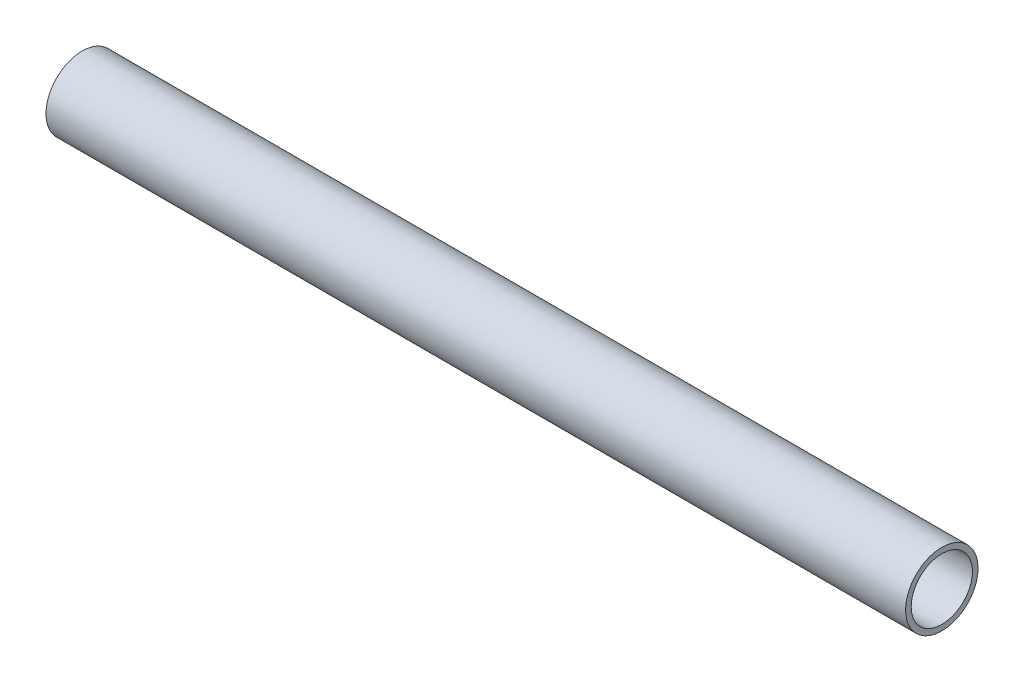
from build123d import *

# Parameters (mm, degrees)
SKETCH1_R           = 5.9055
SKETCH1_R_2         = 4.9911
BOSS_EXTRUDE1_DEPTH = 70.0405
SCALE1_SCALE        = 0.6


with BuildPart() as part:
    # Sketch1 → Boss-Extrude1 (new, symmetric)
    with BuildSketch(Plane(origin=(0, 0, 0), x_dir=(0, 0, -1), z_dir=(1, 0, 0))):
        with Locations(Location((0, 0, 0), (0, 0, 180))):
            Circle(SKETCH1_R)
        with Locations(Location((0, 0, 0), (0, 0, 180))):
            Circle(SKETCH1_R_2, mode=Mode.SUBTRACT)
    extrude(amount=BOSS_EXTRUDE1_DEPTH, both=True)


with BuildPart() as part_1:
    # Scale1: scaled about (0, 0, 0)
    add(part.part.scale(SCALE1_SCALE))


solid = part_1.part
